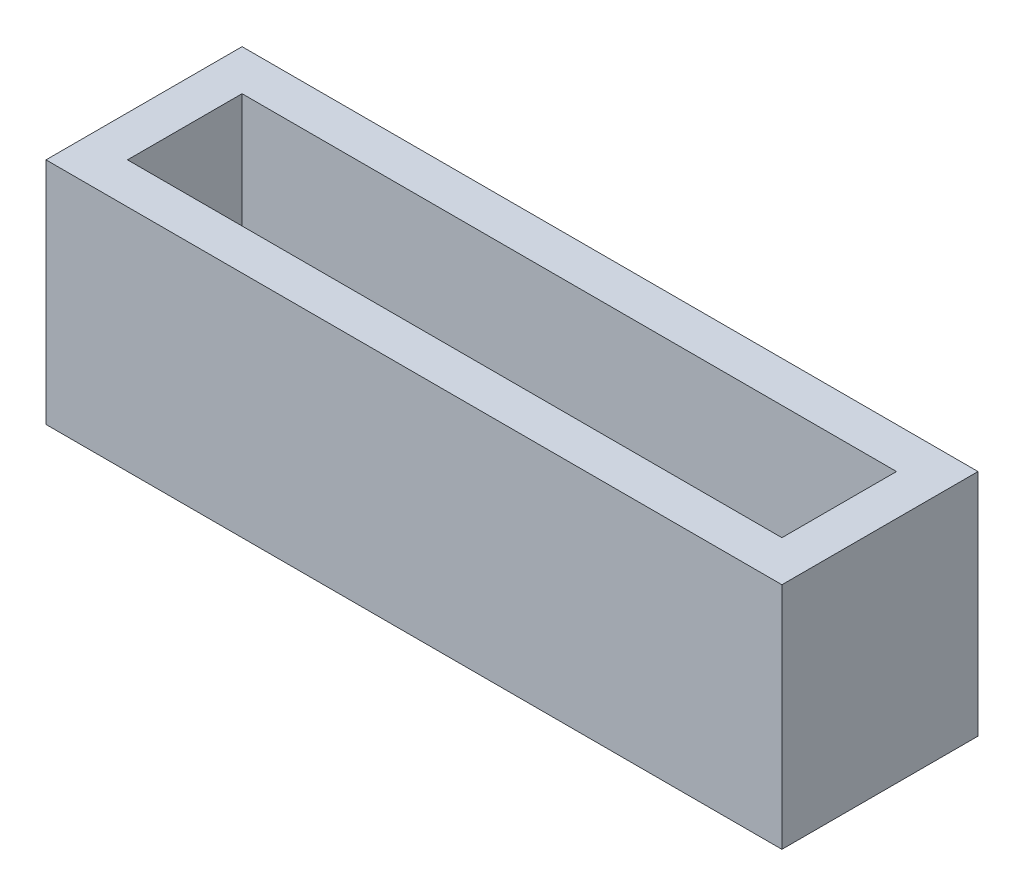
from build123d import *

# Parameters (mm, degrees)
SKETCH1_W           = 28.9
SKETCH1_H           = 7.7
SKETCH1_W_2         = 25.7
SKETCH1_H_2         = 4.5
BOSS_EXTRUDE1_DEPTH = 9


with BuildPart() as part:
    # Sketch1 → Boss-Extrude1 (new body)
    with BuildSketch(Plane(origin=(0, 0, 0), x_dir=(1, 0, 0), z_dir=(0, 1, 0))):
        with Locations((7.123369565, 1.55611413)):
            Rectangle(SKETCH1_W, SKETCH1_H)
        with Locations((7.123369565, 1.55611413)):
            Rectangle(SKETCH1_W_2, SKETCH1_H_2, mode=Mode.SUBTRACT)
    extrude(amount=BOSS_EXTRUDE1_DEPTH)


solid = part.part
